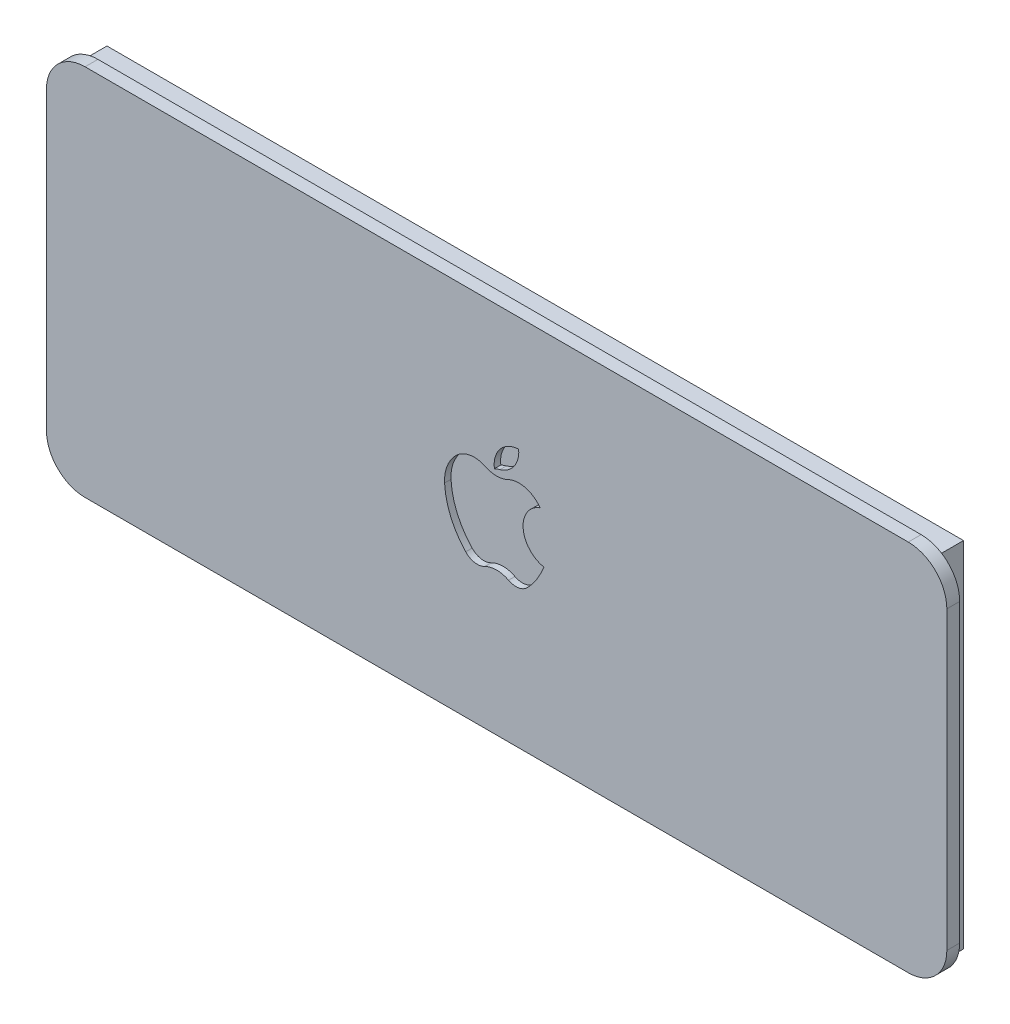
from build123d import *

# Parameters (mm, degrees)
EXTRUDE_1_DEPTH     = 2
CUT_EXTRUDE_2_DEPTH = 1
SKETCH_4_W          = 133.19
SKETCH_4_H          = 55
SKETCH_4_W_2        = 130.19
SKETCH_4_H_2        = 53.761168256
EXTRUDE_2_DEPTH     = 4


with BuildPart() as part:
    # 草图1 → 凸台-拉伸1 (new body)
    with BuildSketch(Plane.XY):
        with BuildLine():
            Line((-64, 29), (64, 29))
            ThreePointArc((64, 29), (68.242640687, 27.242640687), (70, 23))
            Line((70, 23), (70, -23))
            ThreePointArc((70, -23), (68.242640687, -27.242640687), (64, -29))
            Line((64, -29), (-64, -29))
            ThreePointArc((-64, -29), (-68.242640687, -27.242640687), (-70, -23))
            Line((-70, -23), (-70, 23))
            ThreePointArc((-70, 23), (-68.242640687, 27.242640687), (-64, 29))
        make_face()
    extrude(amount=EXTRUDE_1_DEPTH)

    # 草图3 → 切除-拉伸2 (cut)
    with BuildSketch(Plane.XY.offset(2)):
        with BuildLine():
            ThreePointArc((1.846153846, -7.217800499), (3.411683714, -7.465870337), (4.81172184, -6.722690911))
            ThreePointArc((4.81172184, -6.722690911), (6.276265295, -4.837971823), (7.338817992, -2.700675555))
            ThreePointArc((7.338817992, -2.700675555), (4.117591942, 0.931901262), (6.77351325, 4.99613472))
            ThreePointArc((6.77351325, 4.99613472), (6.502838049, 5.308433669), (6.211306836, 5.601359))
            ThreePointArc((6.211306836, 5.601359), (4.080647383, 6.637601762), (1.7375, 6.286647199))
            ThreePointArc((1.7375, 6.286647199), (0, 5.889575695), (-1.7375, 6.286647199))
            ThreePointArc((-1.7375, 6.286647199), (-4.080647383, 6.637601762), (-6.211306835, 5.601359))
            ThreePointArc((-6.211306835, 5.601359), (-7.674507441, 3.461224238), (-8.098236156, 0.903571645))
            ThreePointArc((-8.098236156, 0.903571645), (-7.135696802, -3.20291287), (-4.81172184, -6.722690911))
            ThreePointArc((-4.81172184, -6.722690911), (-3.411683714, -7.465870337), (-1.846153846, -7.217800499))
            ThreePointArc((-1.846153846, -7.217800499), (0, -6.766281297), (1.846153846, -7.217800499))
        make_face()
        with BuildLine():
            ThreePointArc((0.506524653, 7.007542389), (2.728267025, 8.585588777), (3.423600981, 11.22052336))
            ThreePointArc((3.423600981, 11.22052336), (0.540506505, 9.788938293), (-0.354358224, 6.696869944))
            ThreePointArc((-0.354358224, 6.696869944), (0.070150926, 6.868644721), (0.506524653, 7.007542389))
        make_face()
    extrude(amount=-CUT_EXTRUDE_2_DEPTH, mode=Mode.SUBTRACT)

    # 草图4 → 凸台-拉伸2 (add)
    with BuildSketch(Plane(origin=(0, 0, 0), x_dir=(-1, 0, 0), z_dir=(0, 0, -1))):
        Rectangle(SKETCH_4_W, SKETCH_4_H)
        Rectangle(SKETCH_4_W_2, SKETCH_4_H_2, mode=Mode.SUBTRACT)
    extrude(amount=EXTRUDE_2_DEPTH)


solid = part.part
